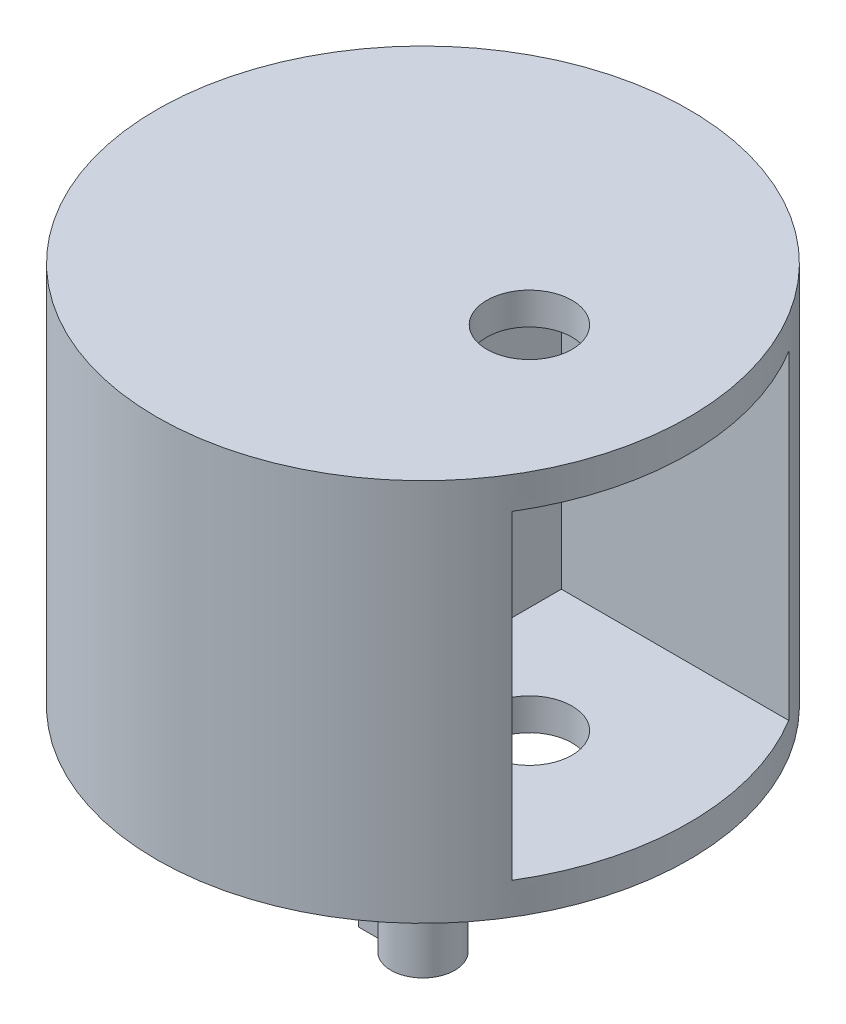
from build123d import *

# Parameters (mm, degrees)
SKETCH1_R           = 12.5
BOSS_EXTRUDE1_DEPTH = 18
SKETCH2_W           = 13
SKETCH2_H           = 15
CUT_EXTRUDE1_DEPTH  = 18
SKETCH3_R           = 2
SKETCH3_R_2         = 1
CUT_EXTRUDE2_DEPTH  = 26.228951623
BOSS_EXTRUDE2_DEPTH = 10


with BuildPart() as part:
    # Sketch1 → Boss-Extrude1 (new body)
    with BuildSketch(Plane(origin=(0, 0, 0), x_dir=(1, 0, 0), z_dir=(0, 1, 0))):
        with Locations(Location((0, 0, 0), (0, 0, 270))):
            Circle(SKETCH1_R)
    extrude(amount=BOSS_EXTRUDE1_DEPTH)

    # Sketch2 → Cut-Extrude1 (cut)
    with BuildSketch(Plane(origin=(0, 0, 0), x_dir=(0, 0, -1), z_dir=(1, 0, 0))):
        with Locations((0, 9)):
            Rectangle(SKETCH2_W, SKETCH2_H)
    extrude(amount=CUT_EXTRUDE1_DEPTH, mode=Mode.SUBTRACT)

    # Sketch3 → Cut-Extrude2 (cut, through all)
    # profile 1 of 2: a face of its own
    with BuildSketch(Plane.XZ):
        with Locations(Location((5, 0, 0), (0, 0, 270))):
            Circle(SKETCH3_R)
        with Locations((5, 0)):
            Circle(SKETCH3_R_2, mode=Mode.SUBTRACT)
    # profile 2 of 2: a face of its own
    with BuildSketch(Plane.XZ):
        with Locations((5, 0)):
            Circle(SKETCH3_R_2)
    extrude(amount=-CUT_EXTRUDE2_DEPTH, mode=Mode.SUBTRACT)

    # Sketch5 → Boss-Extrude2 (add)
    with BuildSketch(Plane.XZ):
        with BuildLine():
            Line((-1.414213562, 0.5), (-2.514213562, 0.5))
            Line((-2.514213562, 0.5), (-2.514213562, -0.5))
            Line((-2.514213562, -0.5), (-1.414213562, -0.5))
            ThreePointArc((-1.414213562, -0.5), (1.5, 0), (-1.414213562, 0.5))
        make_face()
    extrude(amount=BOSS_EXTRUDE2_DEPTH)


solid = part.part
